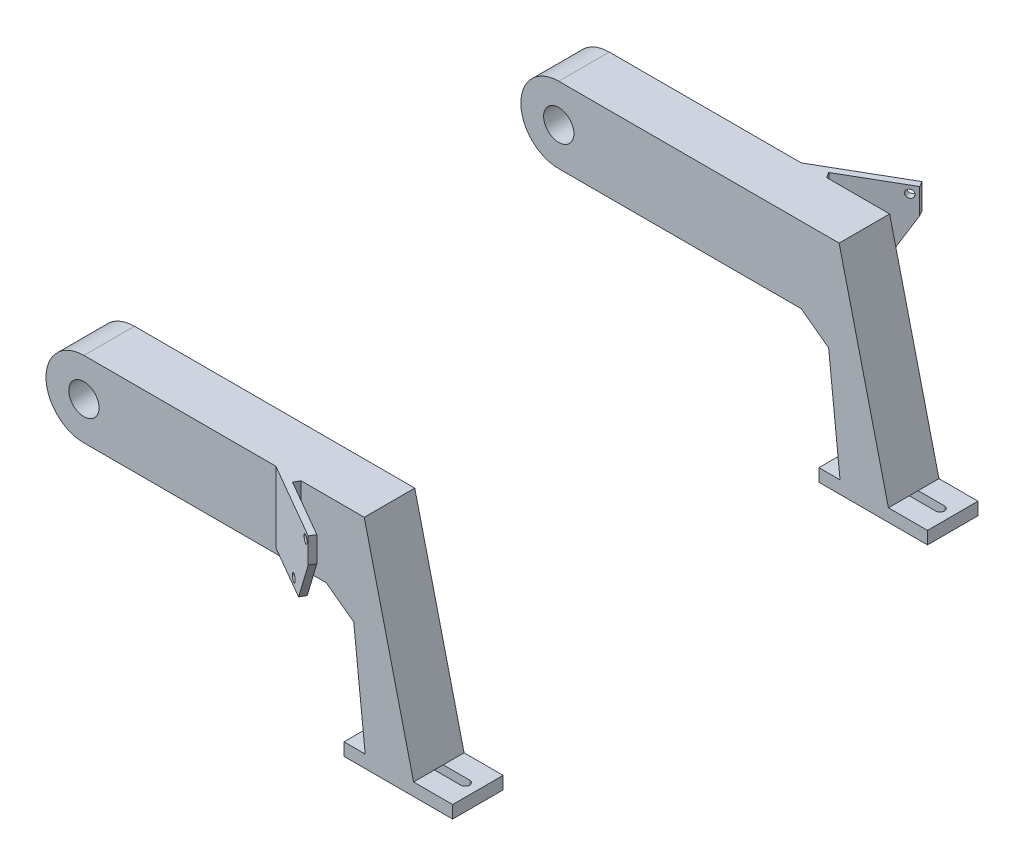
from build123d import *

# Parameters (mm, degrees)
EXTRUDE_1_DEPTH      = 20
SKETCH_9_R           = 6
CUT_EXTRUDE_5_DEPTH  = 128.981833025
EXTRUDE_4_DEPTH      = 20
SKETCH_16_W          = 43
SKETCH_16_H          = 5
EXTRUDE_5_DEPTH      = 20
CUT_EXTRUDE_7_DEPTH  = 145.232318713
EXTRUDE_6_DEPTH      = 30
EXTRUDE_7_DEPTH      = 30
SKETCH_26_R          = 1.55
CUT_EXTRUDE_8_DEPTH  = 10
CUT_EXTRUDE_9_DEPTH  = 10
CUT_EXTRUDE_10_DEPTH = 2
SKETCH_29_W          = 2.5
SKETCH_29_H          = 2
CUT_EXTRUDE_11_DEPTH = 2


with BuildPart() as part:
    # 草图1 → 凸台-拉伸1 (new body)
    with BuildSketch(Plane.XY):
        with BuildLine():
            Line((3.348133201, 16.231891841), (9.233970376, -39.768108159))
            Line((9.233970376, -39.768108159), (29.072758503, -39.768108159))
            Line((29.072758503, -39.768108159), (8.348133201, 46.231891841))
            Line((8.348133201, 46.231891841), (-102.651866799, 46.231891841))
            ThreePointArc((-102.651866799, 46.231891841), (-117.651866799, 31.231891841), (-102.651866799, 16.231891841))
            Line((-102.651866799, 16.231891841), (3.348133201, 16.231891841))
        make_face()
    extrude(amount=EXTRUDE_1_DEPTH)

    # 草图9 → 切除-拉伸5 (cut, through all)
    with BuildSketch(Plane.XY.offset(20)):
        with Locations((-102.651866799, 31.231891841)):
            Circle(SKETCH_9_R)
    extrude(amount=-CUT_EXTRUDE_5_DEPTH, mode=Mode.SUBTRACT)

    # 草图15 → 凸台-拉伸4 (add, through all)
    with BuildSketch(Plane.XY.offset(20)):
        Polygon((4.188967083, 8.231891841), (-6.651866799, 16.231891841), (3.348133201, 16.231891841), align=None)
    extrude(amount=-EXTRUDE_4_DEPTH)

    # 草图16 → 凸台-拉伸5 (add, through all)
    with BuildSketch(Plane.XY.offset(20)):
        with Locations((21.830228257, -37.268108159)):
            Rectangle(SKETCH_16_W, SKETCH_16_H)
    extrude(amount=-EXTRUDE_5_DEPTH)

    # 草图17 → 切除-拉伸7 (cut, through all)
    with BuildSketch(Plane(origin=(0, -34.768108159, 0), x_dir=(1, 0, 0), z_dir=(0, 1, 0))):
        with BuildLine():
            Line((4.330228257, -8.25), (38.330228257, -8.25))
            ThreePointArc((38.330228257, -8.25), (40.080228257, -10), (38.330228257, -11.75))
            Line((38.330228257, -11.75), (4.330228257, -11.75))
            ThreePointArc((4.330228257, -11.75), (2.580228257, -10), (4.330228257, -8.25))
        make_face()
    extrude(amount=-CUT_EXTRUDE_7_DEPTH, mode=Mode.SUBTRACT)

    # 草图23 → 凸台-拉伸6 (add)
    with BuildSketch(Plane(origin=(0, 46.231891841, 0), x_dir=(1, 0, 0), z_dir=(0, 1, 0))):
        Polygon((-26.651866799, -20), (3.659022333, -37.5), (4.909022333, -35.334936491), (-21.651866799, -20), align=None)
    extrude(amount=-EXTRUDE_6_DEPTH)

    # 草图25 → 凸台-拉伸7 (add)
    with BuildSketch(Plane(origin=(0, 46.231891841, 0), x_dir=(1, 0, 0), z_dir=(0, 1, 0))):
        Polygon((-21.651866799, -20), (-16.651866799, -20), (-17.901866799, -22.165063509), align=None)
    extrude(amount=-EXTRUDE_7_DEPTH)

    # 草图26 → 切除-拉伸8 (cut)
    with BuildSketch(Plane(origin=(-15.323220738, 0, 26.540596853), x_dir=(0.866025403784438, 0, 0.5000000000000012), z_dir=(-0.5000000000000012, 0, 0.866025403784438))):
        with Locations((19.030349026, 43.228937097)):
            Circle(SKETCH_26_R)
        with Locations((6.330349026, 21.231891841)):
            Circle(SKETCH_26_R)
    extrude(amount=-CUT_EXTRUDE_8_DEPTH, mode=Mode.SUBTRACT)

    # 草图27 → 切除-拉伸9 (cut)
    with BuildSketch(Plane(origin=(-15.323220738, 0, 26.540596853), x_dir=(0.866025403784438, 0, 0.5000000000000012), z_dir=(-0.5000000000000012, 0, 0.866025403784438))):
        Polygon((21.918806294, 36.231891841), (10.37180091, 16.231891841), (21.918806294, 16.231891841), align=None)
    extrude(amount=-CUT_EXTRUDE_9_DEPTH, mode=Mode.SUBTRACT)

    # 草图28 → 切除-拉伸10 (cut)
    with BuildSketch(Plane.XZ.offset(-16.231891841)):
        Polygon((-26.651866799, 20), (-16.651866799, 20), (-17.901866799, 22.165063509), (-5.090977667, 29.561433799), (-6.340977667, 31.726497308), align=None)
    extrude(amount=-CUT_EXTRUDE_10_DEPTH, mode=Mode.SUBTRACT)

    # 草图29 → 切除-拉伸11 (cut)
    with BuildSketch(Plane(origin=(8.982243071, 0, 5.185900455), x_dir=(-0.5000000000000022, 0, 0.8660254037844374), z_dir=(-0.8660254037844374, 0, -0.5000000000000022))):
        with Locations((29.396441475, 17.231891841)):
            Rectangle(SKETCH_29_W, SKETCH_29_H)
    extrude(amount=-CUT_EXTRUDE_11_DEPTH, mode=Mode.SUBTRACT)


with BuildPart() as body_2:
    # 镜向3: mirrored copy
    add(part.part.mirror(Plane.XY.offset(-84)))


solid = Compound([part.part, body_2.part])
